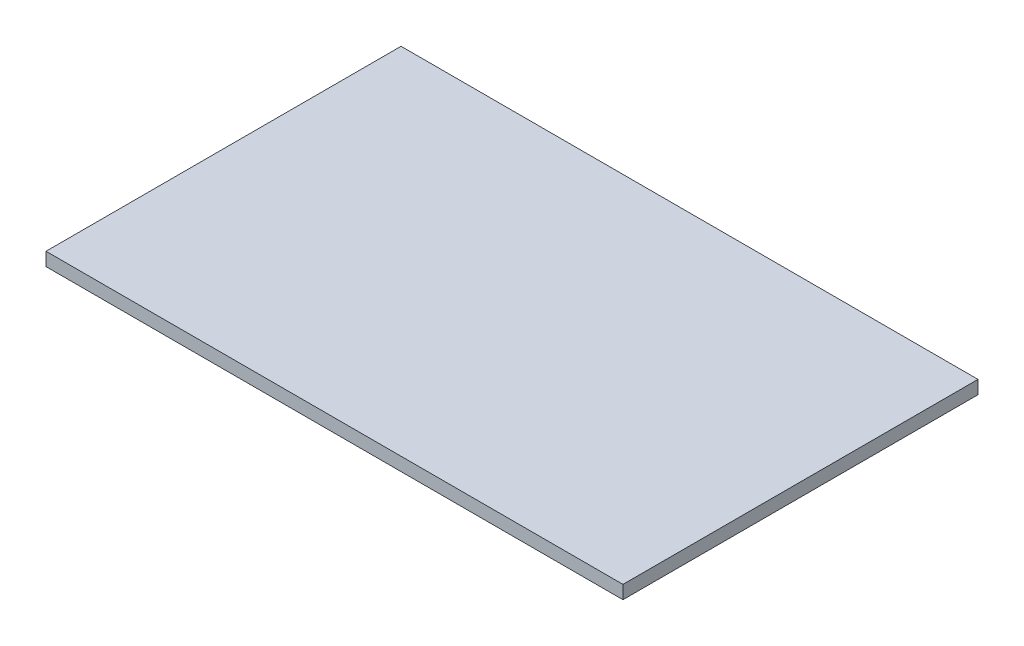
from build123d import *

# Parameters (mm, degrees)
SKETCH1_W           = 130
SKETCH1_H           = 80
BOSS_EXTRUDE1_DEPTH = 3


with BuildPart() as part:
    # Sketch1 → Boss-Extrude1 (new body)
    with BuildSketch(Plane(origin=(0, 0, 0), x_dir=(1, 0, 0), z_dir=(0, 1, 0))):
        Rectangle(SKETCH1_W, SKETCH1_H)
    extrude(amount=BOSS_EXTRUDE1_DEPTH)


solid = part.part
